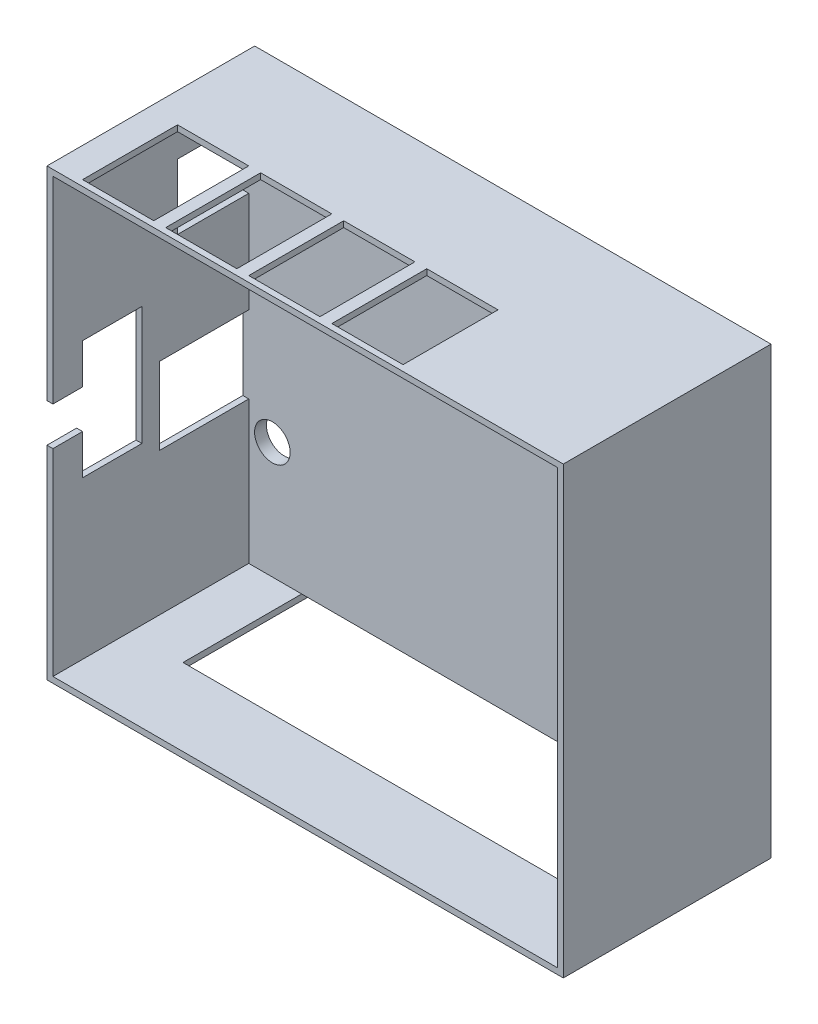
from build123d import *

# Parameters (mm, degrees)
ESQUISSE1_W              = 85
ESQUISSE1_H              = 73
BOSS_EXTRU_2_DEPTH       = 2
ESQUISSE6_W              = 35
ESQUISSE6_H              = 73
BOSS_EXTRU_4_DEPTH       = 1
ESQUISSE8_W              = 35
ESQUISSE8_H              = 73
BOSS_EXTRU_6_DEPTH       = 1
ESQUISSE10_W             = 12
ESQUISSE10_H             = 11
ENL_V_MAT_EXTRU_1_DEPTH  = 1
ESQUISSE11_W             = 15
ESQUISSE11_H             = 13
ENL_V_MAT_EXTRU_2_DEPTH  = 1
ESQUISSE13_W             = 87
ESQUISSE13_H             = 35
BOSS_EXTRU_8_DEPTH       = 1
ESQUISSE14_W             = 12
ESQUISSE14_H             = 16
ENL_V_MAT_EXTRU_3_DEPTH  = 1
ESQUISSE18_W             = 12
ESQUISSE18_H             = 16
ENL_V_MAT_EXTRU_5_DEPTH  = 1
ESQUISSE20_W             = 12
ESQUISSE20_H             = 16
ENL_V_MAT_EXTRU_6_DEPTH  = 1
ESQUISSE21_W             = 12
ESQUISSE21_H             = 16
ENL_V_MAT_EXTRU_7_DEPTH  = 1
ESQUISSE25_W             = 87
ESQUISSE25_H             = 35
BOSS_EXTRU_11_DEPTH      = 1
ESQUISSE26_W             = 77
ESQUISSE26_H             = 22
ENL_V_MAT_EXTRU_13_DEPTH = 1
ESQUISSE23_R             = 3
ENL_V_MAT_EXTRU_14_DEPTH = 10
ESQUISSE22_R             = 3
ENL_V_MAT_EXTRU_15_DEPTH = 10
ESQUISSE24_R             = 3
ENL_V_MAT_EXTRU_18_DEPTH = 10
ESQUISSE27_W             = 10
ESQUISSE27_H             = 20
ENL_V_MAT_EXTRU_19_DEPTH = 1
ESQUISSE28_W             = 5
ESQUISSE28_H             = 6.5
ENL_V_MAT_EXTRU_20_DEPTH = 10


with BuildPart() as part:
    # Esquisse1 → Boss.-Extru.2 (new body)
    with BuildSketch(Plane.XY):
        with Locations((-89.704998798, 36.5)):
            Rectangle(ESQUISSE1_W, ESQUISSE1_H)
    extrude(amount=BOSS_EXTRU_2_DEPTH)

    # Esquisse6 → Boss.-Extru.4 (add)
    with BuildSketch(Plane(origin=(-47.204998798, 0, 0), x_dir=(0, 0, -1), z_dir=(1, 0, 0))):
        with Locations((-17.5, 36.5)):
            Rectangle(ESQUISSE6_W, ESQUISSE6_H)
    extrude(amount=BOSS_EXTRU_4_DEPTH)

    # Esquisse8 → Boss.-Extru.6 (add)
    with BuildSketch(Plane.ZY.offset(132.204998798)):
        with Locations((17.5, 36.5)):
            Rectangle(ESQUISSE8_W, ESQUISSE8_H)
    extrude(amount=BOSS_EXTRU_6_DEPTH)

    # Esquisse10 → Enlèv. mat.-Extru.1 (cut)
    with BuildSketch(Plane.ZY.offset(133.204998798)):
        with Locations((8, 59.5)):
            Rectangle(ESQUISSE10_W, ESQUISSE10_H)
    extrude(amount=-ENL_V_MAT_EXTRU_1_DEPTH, mode=Mode.SUBTRACT)

    # Esquisse11 → Enlèv. mat.-Extru.2 (cut)
    with BuildSketch(Plane.ZY.offset(133.204998798)):
        with Locations((9.5, 30.5)):
            Rectangle(ESQUISSE11_W, ESQUISSE11_H)
    extrude(amount=-ENL_V_MAT_EXTRU_2_DEPTH, mode=Mode.SUBTRACT)

    # Esquisse13 → Boss.-Extru.8 (add)
    with BuildSketch(Plane(origin=(0, 73, 0), x_dir=(1, 0, 0), z_dir=(0, 1, 0))):
        with Locations((-89.704998798, -17.5)):
            Rectangle(ESQUISSE13_W, ESQUISSE13_H)
    extrude(amount=BOSS_EXTRU_8_DEPTH)

    # Esquisse14 → Enlèv. mat.-Extru.3 (cut)
    with BuildSketch(Plane(origin=(0, 74, 0), x_dir=(1, 0, 0), z_dir=(0, 1, 0))):
        with Locations((-122.207040337, -26)):
            Rectangle(ESQUISSE14_W, ESQUISSE14_H)
    extrude(amount=-ENL_V_MAT_EXTRU_3_DEPTH, mode=Mode.SUBTRACT)

    # Esquisse18 → Enlèv. mat.-Extru.5 (cut)
    with BuildSketch(Plane(origin=(0, 74, 0), x_dir=(1, 0, 0), z_dir=(0, 1, 0))):
        with Locations((-108.207040337, -26)):
            Rectangle(ESQUISSE18_W, ESQUISSE18_H)
    extrude(amount=-ENL_V_MAT_EXTRU_5_DEPTH, mode=Mode.SUBTRACT)

    # Esquisse20 → Enlèv. mat.-Extru.6 (cut)
    with BuildSketch(Plane(origin=(0, 74, 0), x_dir=(1, 0, 0), z_dir=(0, 1, 0))):
        with Locations((-94.207040337, -26)):
            Rectangle(ESQUISSE20_W, ESQUISSE20_H)
    extrude(amount=-ENL_V_MAT_EXTRU_6_DEPTH, mode=Mode.SUBTRACT)

    # Esquisse21 → Enlèv. mat.-Extru.7 (cut)
    with BuildSketch(Plane(origin=(0, 74, 0), x_dir=(1, 0, 0), z_dir=(0, 1, 0))):
        with Locations((-80.207040337, -26)):
            Rectangle(ESQUISSE21_W, ESQUISSE21_H)
    extrude(amount=-ENL_V_MAT_EXTRU_7_DEPTH, mode=Mode.SUBTRACT)

    # Esquisse25 → Boss.-Extru.11 (add)
    with BuildSketch(Plane.XZ):
        with Locations((-89.704998798, 17.5)):
            Rectangle(ESQUISSE25_W, ESQUISSE25_H)
    extrude(amount=BOSS_EXTRU_11_DEPTH)

    # Esquisse26 → Enlèv. mat.-Extru.13 (cut)
    with BuildSketch(Plane.XZ.offset(1)):
        with Locations((-84.785991567, 11)):
            Rectangle(ESQUISSE26_W, ESQUISSE26_H)
    extrude(amount=-ENL_V_MAT_EXTRU_13_DEPTH, mode=Mode.SUBTRACT)

    # Esquisse23 → Enlèv. mat.-Extru.14 (cut)
    with BuildSketch(Plane.XY.offset(2)):
        with Locations((-128.228777758, 19.66052326)):
            Circle(ESQUISSE23_R)
    extrude(amount=-ENL_V_MAT_EXTRU_14_DEPTH, mode=Mode.SUBTRACT)

    # Esquisse22 → Enlèv. mat.-Extru.15 (cut)
    with BuildSketch(Plane.XY.offset(2)):
        with Locations((-128.334603856, 69.17039525)):
            Circle(ESQUISSE22_R)
    extrude(amount=-ENL_V_MAT_EXTRU_15_DEPTH, mode=Mode.SUBTRACT)

    # Esquisse24 → Enlèv. mat.-Extru.18 (cut)
    with BuildSketch(Plane.XY.offset(2)):
        with Locations((-70.21638406, 69.222983718)):
            Circle(ESQUISSE24_R)
    extrude(amount=-ENL_V_MAT_EXTRU_18_DEPTH, mode=Mode.SUBTRACT)

    # Esquisse27 → Enlèv. mat.-Extru.19 (cut)
    with BuildSketch(Plane.ZY.offset(133.204998798)):
        with Locations((25, 36.5)):
            Rectangle(ESQUISSE27_W, ESQUISSE27_H)
    extrude(amount=-ENL_V_MAT_EXTRU_19_DEPTH, mode=Mode.SUBTRACT)

    # Esquisse28 → Enlèv. mat.-Extru.20 (cut)
    with BuildSketch(Plane.ZY.offset(133.204998798)):
        with Locations((32.5, 36.5)):
            Rectangle(ESQUISSE28_W, ESQUISSE28_H)
    extrude(amount=-ENL_V_MAT_EXTRU_20_DEPTH, mode=Mode.SUBTRACT)


solid = part.part
